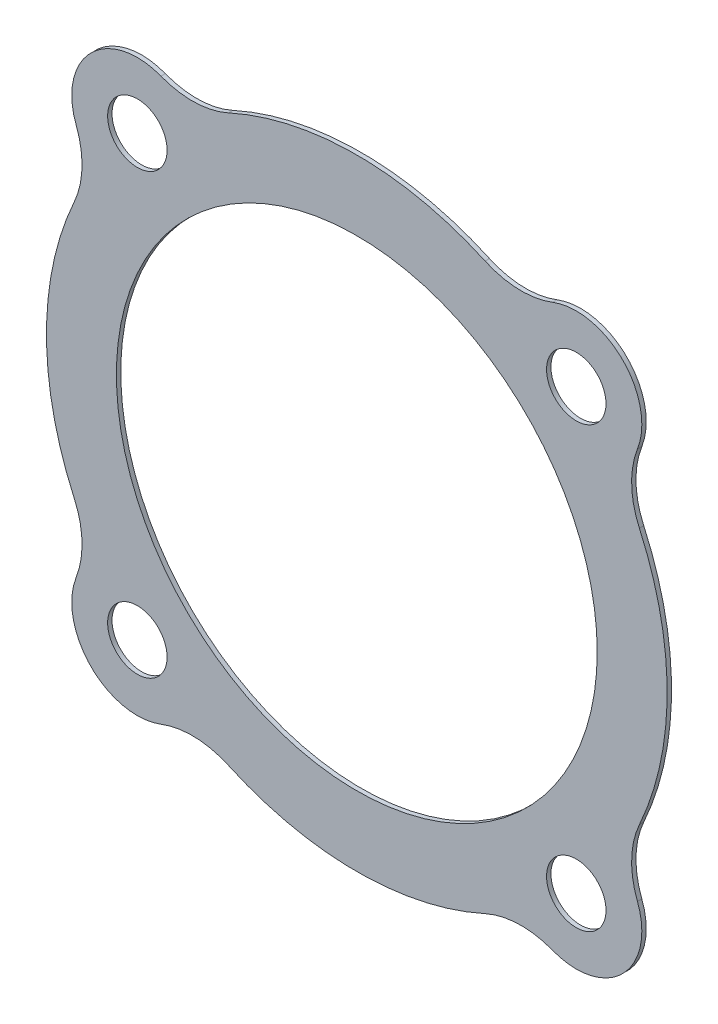
from build123d import *

# Parameters (mm, degrees)
SKETCH1_R           = 34.925
SKETCH1_R_2         = 4.318
BOSS_EXTRUDE1_DEPTH = 0.635


with BuildPart() as part:
    # Sketch1 → Boss-Extrude1 (new body)
    with BuildSketch(Plane.XY):
        with BuildLine():
            ThreePointArc((-41.05309521, 18.636002755), (-45.085, 0), (-41.05309521, -18.636002755))
            ThreePointArc((-41.05309521, -18.636002755), (-39.922721795, -23.516147348), (-40.767382723, -28.453768558))
            ThreePointArc((-40.767382723, -28.453768558), (-38.615101321, -38.615101321), (-28.453768558, -40.767382723))
            ThreePointArc((-28.453768558, -40.767382723), (-23.516147348, -39.922721795), (-18.636002755, -41.05309521))
            ThreePointArc((-18.636002755, -41.05309521), (0, -45.085), (18.636002755, -41.05309521))
            ThreePointArc((18.636002755, -41.05309521), (23.516147348, -39.922721795), (28.453768558, -40.767382723))
            ThreePointArc((28.453768558, -40.767382723), (38.615101321, -38.615101321), (40.767382723, -28.453768558))
            ThreePointArc((40.767382723, -28.453768558), (39.922721795, -23.516147348), (41.05309521, -18.636002755))
            ThreePointArc((41.05309521, -18.636002755), (45.085, 0), (41.05309521, 18.636002755))
            ThreePointArc((41.05309521, 18.636002755), (39.922721795, 23.516147348), (40.767382723, 28.453768558))
            ThreePointArc((40.767382723, 28.453768558), (38.615101321, 38.615101321), (28.453768558, 40.767382723))
            ThreePointArc((28.453768558, 40.767382723), (23.516147348, 39.922721795), (18.636002755, 41.05309521))
            ThreePointArc((18.636002755, 41.05309521), (0, 45.085), (-18.636002755, 41.05309521))
            ThreePointArc((-18.636002755, 41.05309521), (-23.516147348, 39.922721795), (-28.453768558, 40.767382723))
            ThreePointArc((-28.453768558, 40.767382723), (-38.615101321, 38.615101321), (-40.767382723, 28.453768558))
            ThreePointArc((-40.767382723, 28.453768558), (-39.922721795, 23.516147348), (-41.05309521, 18.636002755))
        make_face()
        Circle(SKETCH1_R, mode=Mode.SUBTRACT)
        with Locations((31.87990923, 31.87990923)):
            Circle(SKETCH1_R_2, mode=Mode.SUBTRACT)
        with Locations((-31.87990923, 31.87990923)):
            Circle(SKETCH1_R_2, mode=Mode.SUBTRACT)
        with Locations((-31.87990923, -31.87990923)):
            Circle(SKETCH1_R_2, mode=Mode.SUBTRACT)
        with Locations((31.87990923, -31.87990923)):
            Circle(SKETCH1_R_2, mode=Mode.SUBTRACT)
    extrude(amount=BOSS_EXTRUDE1_DEPTH)


solid = part.part
